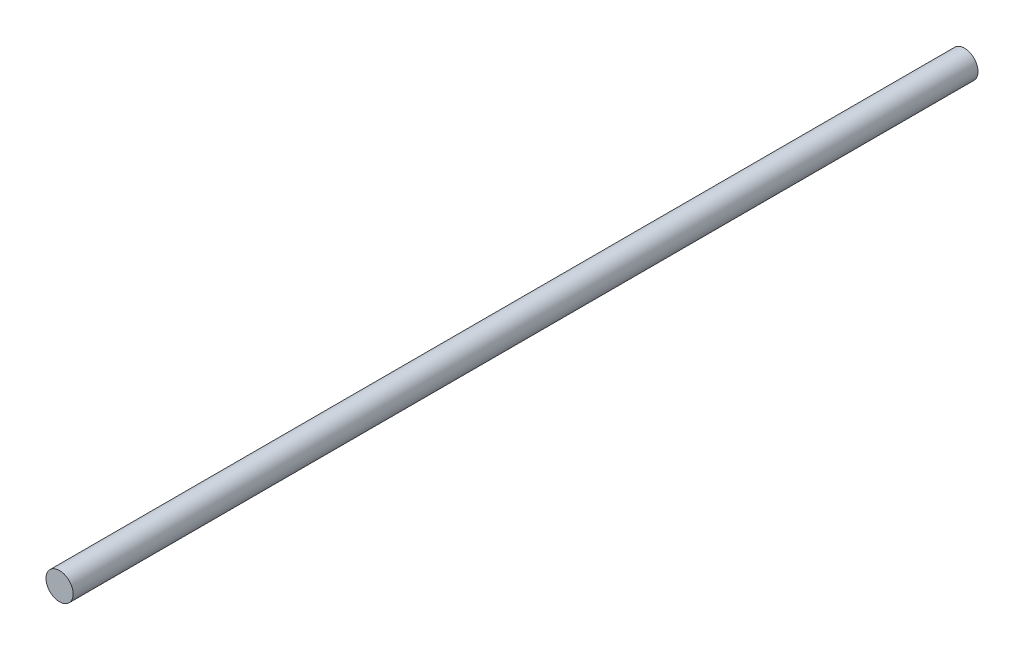
from build123d import *

# Parameters (mm, degrees)
SKETCH1_R           = 4.7625
BOSS_EXTRUDE1_DEPTH = 317.5


with BuildPart() as part:
    # Sketch1 → Boss-Extrude1 (new body)
    with BuildSketch(Plane.XY):
        Circle(SKETCH1_R)
    extrude(amount=-BOSS_EXTRUDE1_DEPTH)


solid = part.part
